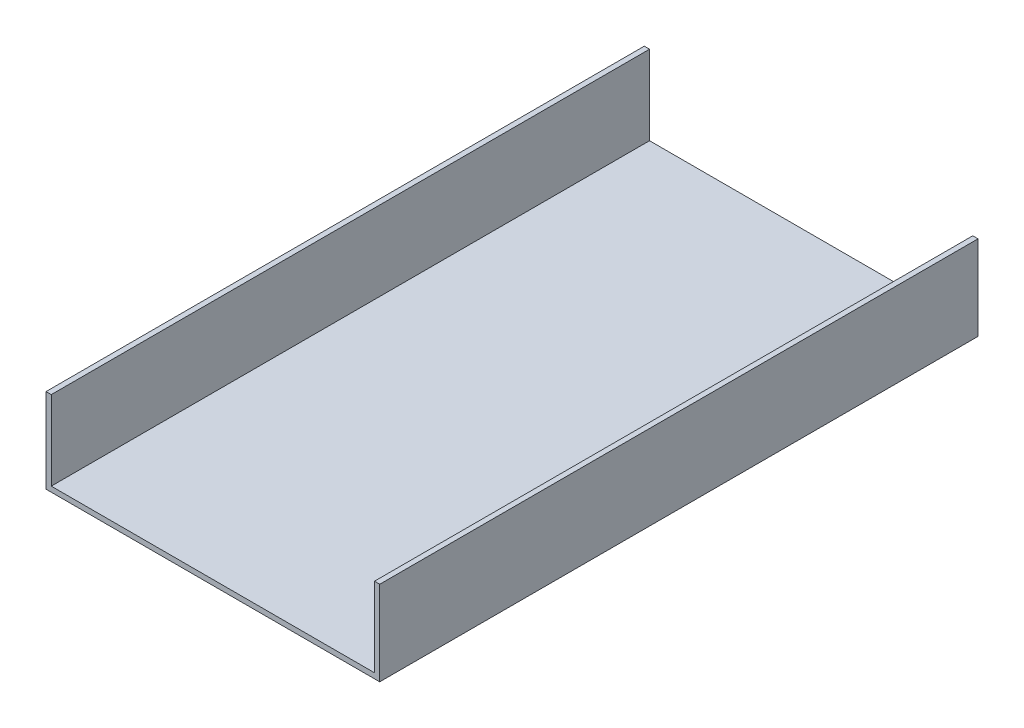
from build123d import *

# Parameters (mm, degrees)
CROQUIS1_W              = 101.54
CROQUIS1_H              = 25.72
CROQUIS1_W_2            = 98.34
CROQUIS1_H_2            = 22.52
SALIENTE_EXTRUIR1_DEPTH = 91.02
CROQUIS2_W              = 98.34
CROQUIS2_H              = 182.04
CORTAR_EXTRUIR1_DEPTH   = 6.04


with BuildPart() as part:
    # Croquis1 → Saliente-Extruir1 (new, symmetric)
    with BuildSketch(Plane.XY):
        with Locations((-27.147074341, -0.246714628)):
            Rectangle(CROQUIS1_W, CROQUIS1_H)
        with Locations((-27.147074341, -0.246714628)):
            Rectangle(CROQUIS1_W_2, CROQUIS1_H_2, mode=Mode.SUBTRACT)
    extrude(amount=SALIENTE_EXTRUIR1_DEPTH, both=True)

    # Croquis2 → Cortar-Extruir1 (cut)
    with BuildSketch(Plane(origin=(0, 12.613285372, 0), x_dir=(1, 0, 0), z_dir=(0, 1, 0))):
        with Locations((-27.147074341, 0)):
            Rectangle(CROQUIS2_W, CROQUIS2_H)
    extrude(amount=-CORTAR_EXTRUIR1_DEPTH, mode=Mode.SUBTRACT)


solid = part.part
